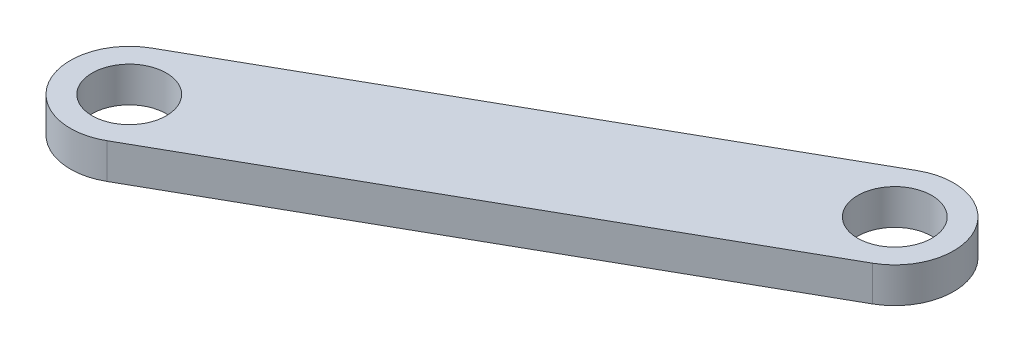
from build123d import *

# Parameters (mm, degrees)
SKETCH1_R           = 2
BOSS_EXTRUDE1_DEPTH = 1.905


with BuildPart() as part:
    # Sketch1 → Boss-Extrude1 (new body)
    with BuildSketch(Plane(origin=(0, 0, 0), x_dir=(1, 0, 0), z_dir=(0, 1, 0))):
        with BuildLine():
            Line((1.564021986, -2.763052701), (-24.798557496, -17.685552701))
            ThreePointArc((-24.798557496, -17.685552701), (-29.125632183, -16.486521986), (-27.926601468, -12.159447299))
            Line((-27.926601468, -12.159447299), (-1.564021986, 2.763052701))
            ThreePointArc((-1.564021986, 2.763052701), (2.763052701, 1.564021986), (1.564021986, -2.763052701))
        make_face()
        with Locations(Location((0, 0, 0), (0, 0, 270))):
            Circle(SKETCH1_R, mode=Mode.SUBTRACT)
        with Locations(Location((-26.362579482, -14.9225, 0), (0, 0, 270))):
            Circle(SKETCH1_R, mode=Mode.SUBTRACT)
    extrude(amount=-BOSS_EXTRUDE1_DEPTH)


solid = part.part
